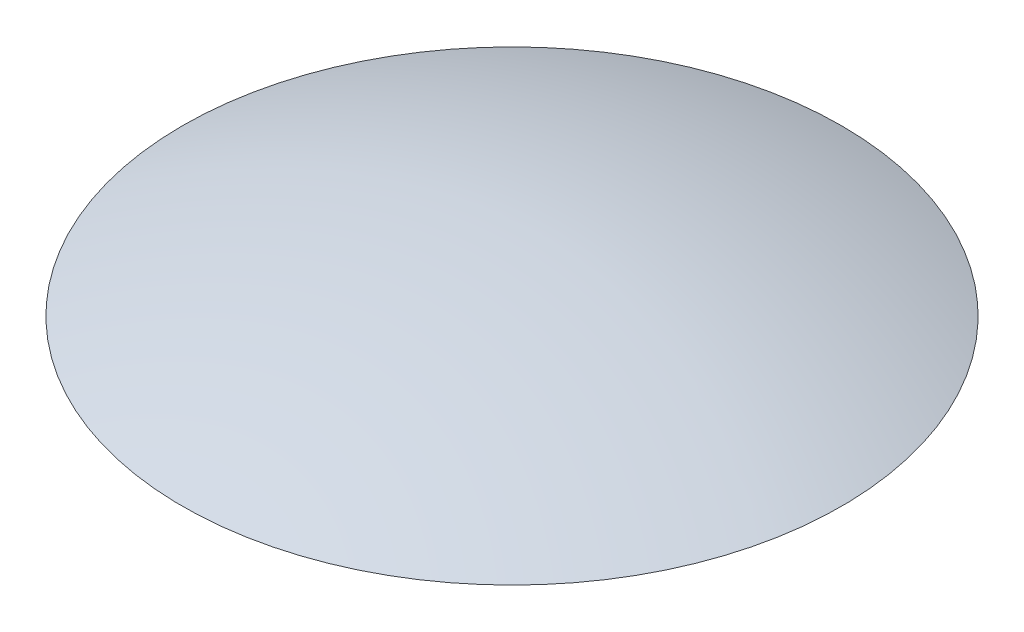
from build123d import *

# Parameters (mm, degrees)
SKETCH1_R           = 3
SKETCH1_R_2         = 2.5
BOSS_EXTRUDE1_DEPTH = 1


with BuildPart() as part:
    # Sketch1 → Boss-Extrude1 (new body)
    with BuildSketch(Plane(origin=(0, 0, 0), x_dir=(1, 0, 0), z_dir=(0, 1, 0))):
        with Locations(Location((0, 0, 0), (0, 0, 270))):
            Circle(SKETCH1_R)
        with Locations(Location((0, 0, 0), (0, 0, 270))):
            Circle(SKETCH1_R_2, mode=Mode.SUBTRACT)
    extrude(amount=BOSS_EXTRUDE1_DEPTH)

    # Sketch4 → Revolve3 (revolve)
    with BuildSketch(Plane.XY, mode=Mode.PRIVATE) as revolve3_sk:
        with BuildLine():
            Line((0, 1), (-5, 1))
            add(Edge.make_bspline(
                [(-5, 1), (-2.5, 2), (0, 2)],
                knots=[0, 0, 0, 0.5, 0.5, 0.5], degree=2))
            Line((0, 2), (0, 1))
        make_face()
    revolve(revolve3_sk.sketch.rotate(Axis((0, 0, 0), (0, 1, 0)), 270), axis=Axis((0, 0, 0), (0, 1, 0)))


solid = part.part
